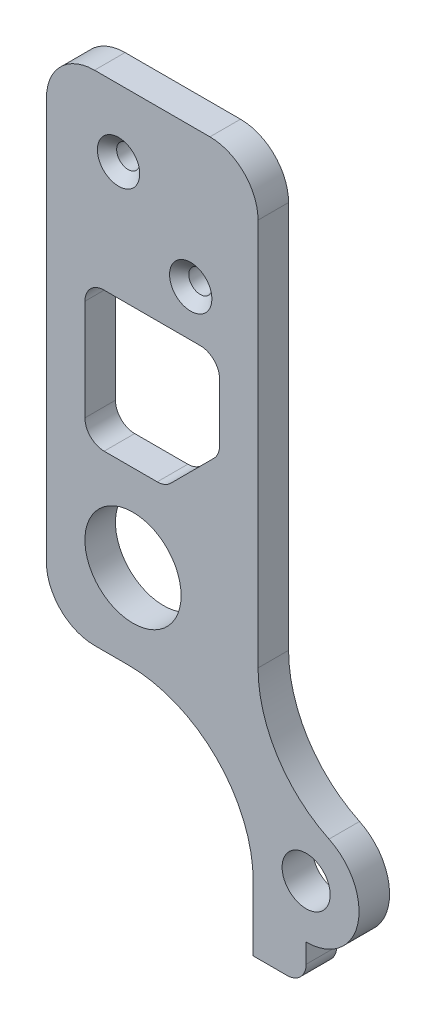
from build123d import *

# Parameters (mm, degrees)
SKETCH1_R                                       = 2.5
SKETCH1_R_2                                     = 5
BOSS_EXTRUDE1_DEPTH                             = 3.175
CSK_FOR_M2_FLAT_HEAD_MACHINE_SCREW3_D           = 2.4
CSK_FOR_M2_FLAT_HEAD_MACHINE_SCREW3_CSINK_D     = 4.4
CSK_FOR_M2_FLAT_HEAD_MACHINE_SCREW3_CSINK_ANGLE = 90
CUT_EXTRUDE2_DEPTH                              = 68.698453638
F_5MM_FILLET_R                                  = 5
F_2MM_FILLET_R                                  = 2
F_1MM_FILLET_R                                  = 1
CUT_EXTRUDE3_DEPTH                              = 68.698453638
FILLET1_R                                       = 5
BOSS_EXTRUDE2_DEPTH                             = 3.175
BOSS_EXTRUDE3_START                             = -3.175
SKETCH14_W                                      = 5.5
SKETCH14_H                                      = 4
BOSS_EXTRUDE3_DEPTH                             = 3.175
FILLET3_R                                       = 2
CUT_EXTRUDE6_DEPTH                              = 68.698453638
CUT_EXTRUDE6_DEPTH_BACK                         = 10
FILLET6_R                                       = 13
FILLET7_R                                       = 13


with BuildPart() as part:
    # Sketch1 → Boss-Extrude1 (new body)
    with BuildSketch(Plane.XY):
        with BuildLine():
            Line((0, -5.5), (-7, -5.5))
            Line((-7, -5.5), (-7, -9))
            Line((-7, -9), (-12, -9))
            Line((-12, -9), (-12, -2.5))
            Line((-12, -2.5), (-27, 4.494614872))
            Line((-27, 4.494614872), (-27, 62))
            Line((-27, 62), (-5, 62))
            Line((-5, 62), (-5, 32.19632141))
            Line((-5, 32.19632141), (-9, 28.19632141))
            Line((-9, 28.19632141), (-9, 10.265347478))
            Line((-9, 10.265347478), (2.32440044, 4.984692829))
            ThreePointArc((2.32440044, 4.984692829), (5.369628039, -1.190417877), (0, -5.5))
        make_face()
        Circle(SKETCH1_R, mode=Mode.SUBTRACT)
        with Locations((-18, 19.2)):
            Circle(SKETCH1_R_2, mode=Mode.SUBTRACT)
    extrude(amount=BOSS_EXTRUDE1_DEPTH)

    # CSK for M2 Flat Head Machine Screw3 (through all)
    with Locations(Plane.XY.offset(3.175)):
        with Locations((-19.5, 55), (-12, 47.5)):
            CounterSinkHole(CSK_FOR_M2_FLAT_HEAD_MACHINE_SCREW3_D / 2, CSK_FOR_M2_FLAT_HEAD_MACHINE_SCREW3_CSINK_D / 2, counter_sink_angle=CSK_FOR_M2_FLAT_HEAD_MACHINE_SCREW3_CSINK_ANGLE)

    # Sketch11 → Cut-Extrude2 (cut, through all)
    with BuildSketch(Plane.XY.offset(3.175)):
        Polygon((-23, 28.19632141), (-23, 42.69632141), (-9, 42.69632141), (-9, 33.85317566), (-14.65, 28.19632141), align=None)
    extrude(amount=-CUT_EXTRUDE2_DEPTH, mode=Mode.SUBTRACT)

    # 5mm_Fillet
    f_5mm_fillet_edges = [part.edges().sort_by_distance(p)[0] for p in [
        (-12, -2.5, 1.5875),
        (-27, 4.494614872, 1.5875),
        (-27, 62, 1.5875),
        (-5, 62, 1.5875),
        (-5, 32.19632141, 1.5875),
        (-9, 28.19632141, 1.5875),
        (-9, 10.265347478, 1.5875),
    ]]
    fillet(f_5mm_fillet_edges, radius=F_5MM_FILLET_R)

    # 2mm_Fillet
    f_2mm_fillet_edges = [part.edges().sort_by_distance(p)[0] for p in [
        (-14.65, 28.19632141, 1.5875),
        (-23, 28.19632141, 1.5875),
        (-23, 42.69632141, 1.5875),
        (-9, 42.69632141, 1.5875),
        (-9, 33.85317566, 1.5875),
    ]]
    fillet(f_2mm_fillet_edges, radius=F_2MM_FILLET_R)

    # 1mm_Fillet
    f_1mm_fillet_edges = [part.edges().sort_by_distance(p)[0] for p in [
        (-7, -5.5, 1.5875),
        (-7, -9, 1.5875),
    ]]
    fillet(f_1mm_fillet_edges, radius=F_1MM_FILLET_R)

    # Sketch12 → Cut-Extrude3 (cut, through all)
    with BuildSketch(Plane.XY.offset(3.175)):
        with BuildLine():
            Line((-27, 10.199636133), (-27, -4.690363867))
            Line((-27, -4.690363867), (-12.1, -4.690363867))
            Line((-12.1, -4.690363867), (-12.1, 5.199636133))
            ThreePointArc((-12.1, 5.199636133), (-13.564466094, 8.735170039), (-17.1, 10.199636133))
            Line((-17.1, 10.199636133), (-27, 10.199636133))
        make_face()
    extrude(amount=-CUT_EXTRUDE3_DEPTH, mode=Mode.SUBTRACT)

    # Fillet1
    fillet1_edges = [part.edges().sort_by_distance(p)[0] for p in [
        (-27, 10.199636133, 1.5875),
    ]]
    fillet(fillet1_edges, radius=FILLET1_R)

    # Sketch13 → Boss-Extrude2 (add)
    with BuildSketch(Plane.XY.offset(3.175)):
        with BuildLine():
            Line((-5, 34.267389222), (-5, 8.400116845))
            Line((-5, 8.400116845), (-6.113091309, 8.919159847))
            ThreePointArc((-6.113091309, 8.919159847), (-8.216957229, 10.76420074), (-9, 13.450698782))
            Line((-9, 13.450698782), (-9, 26.125253598))
            ThreePointArc((-9, 26.125253598), (-8.619397663, 28.03867076), (-7.535533906, 29.660787504))
            Line((-7.535533906, 29.660787504), (-6.464466094, 30.731855316))
            ThreePointArc((-6.464466094, 30.731855316), (-5.380602337, 32.35397206), (-5, 34.267389222))
        make_face()
    extrude(amount=-BOSS_EXTRUDE2_DEPTH)

    # Sketch14 → Boss-Extrude3 (add)
    with BuildSketch(Plane.XY.offset(3.175).offset(BOSS_EXTRUDE3_START)):
        with Locations((-2.75, -7.5)):
            Rectangle(SKETCH14_W, SKETCH14_H)
        with BuildLine():
            ThreePointArc((0, -5.5), (-3.889087297, -3.889087297), (-5.5, 0))
            Line((-5.5, 0), (-5.5, -5.5))
            Line((-5.5, -5.5), (0, -5.5))
        make_face()
    extrude(amount=BOSS_EXTRUDE3_DEPTH)

    # Fillet3
    fillet3_edges = [part.edges().sort_by_distance(p)[0] for p in [
        (0, -9.5, 1.5875),
    ]]
    fillet(fillet3_edges, radius=FILLET3_R)

    # Sketch15 → Cut-Extrude6 (cut, two sides: drawn at the far end of the back side and taken through both)
    with BuildSketch(Plane.XY.offset(3.175).offset(-CUT_EXTRUDE6_DEPTH_BACK)):
        with BuildLine():
            Line((-5.5, 10.199636133), (-17.1, 10.199636133))
            ThreePointArc((-17.1, 10.199636133), (-13.564466094, 8.735170039), (-12.1, 5.199636133))
            Line((-12.1, 5.199636133), (-12.1, -4.690363867))
            ThreePointArc((-12.1, -4.690363867), (-12.035186912, -5.09321027), (-12.003436692, -5.5))
            Line((-12.003436692, -5.5), (-6, -5.5))
            Line((-6, -5.5), (-5.5, -5.5))
            Line((-5.5, -5.5), (-5.5, 10.199636133))
        make_face()
    extrude(amount=CUT_EXTRUDE6_DEPTH + CUT_EXTRUDE6_DEPTH_BACK, mode=Mode.SUBTRACT)


with BuildPart() as body_2:
    # of the pieces the cut leaves, the one that is kept (cut_extrude6_keep)
    add(part.part.solids().sort_by_distance((0, -7.5, 0))[0])

    # Fillet6
    fillet6_edges = [body_2.edges().sort_by_distance(p)[0] for p in [
        (-5.5, 10.199636133, 1.5875),
    ]]
    fillet(fillet6_edges, radius=FILLET6_R)

    # Fillet7
    fillet7_edges = [body_2.edges().sort_by_distance(p)[0] for p in [
        (-5, 8.400116845, 1.5875),
    ]]
    fillet(fillet7_edges, radius=FILLET7_R)


solid = body_2.part
